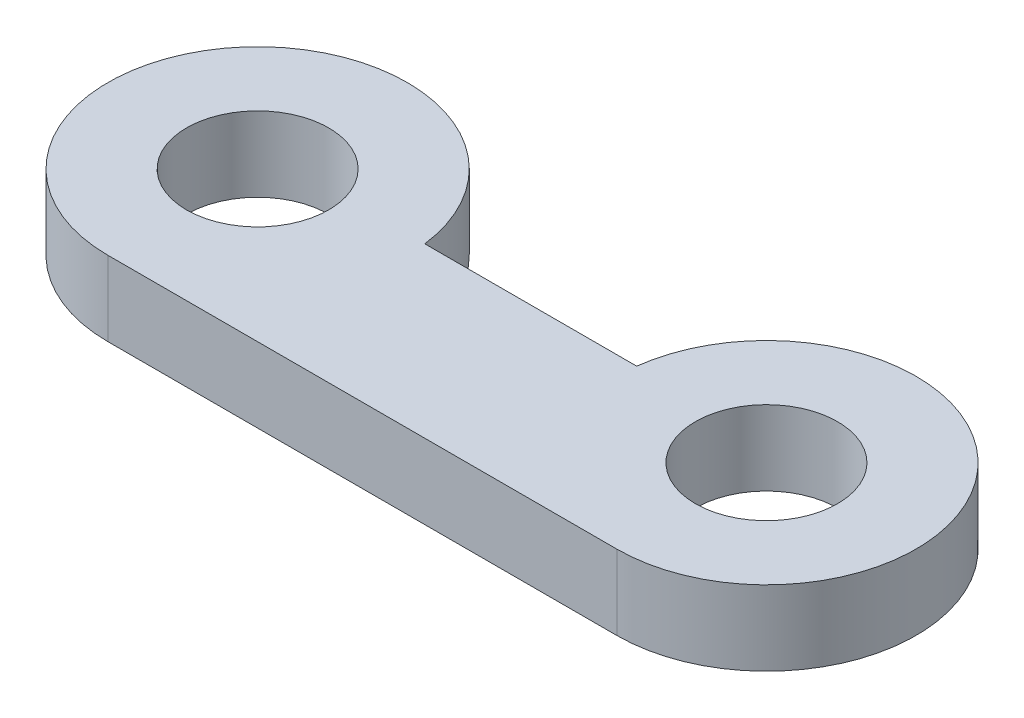
from build123d import *

# Parameters (mm, degrees)
SKETCH1_R           = 4
SKETCH1_R_2         = 1.9
BOSS_EXTRUDE1_DEPTH = 2


with BuildPart() as part:
    # Sketch1 → Boss-Extrude1 (new body)
    # profile 1 of 4: a face of its own
    with BuildSketch(Plane(origin=(0, 0, 0), x_dir=(1, 0, 0), z_dir=(0, 1, 0))):
        with Locations((-6.8, 4)):
            Circle(SKETCH1_R)
        with Locations(Location((-6.8, 4, 0), (0, 0, 270))):
            Circle(SKETCH1_R_2, mode=Mode.SUBTRACT)
    # profile 2 of 4: a face of its own
    with BuildSketch(Plane(origin=(0, 0, 0), x_dir=(1, 0, 0), z_dir=(0, 1, 0))):
        with BuildLine():
            Line((-6.8, 0), (0, 0))
            Line((0, 0), (0, 4.5))
            Line((0, 4.5), (-2.831373033, 4.5))
            ThreePointArc((-2.831373033, 4.5), (-2.807850963, 4.25049165), (-2.8, 4))
            ThreePointArc((-2.8, 4), (-3.971572875, 1.171572875), (-6.8, 0))
        make_face()
    # profile 3 of 4: a face of its own
    with BuildSketch(Plane(origin=(0, 0, 0), x_dir=(1, 0, 0), z_dir=(0, 1, 0))):
        with BuildLine():
            Line((0, 4.5), (0, 0))
            Line((0, 0), (6.8, 0))
            ThreePointArc((6.8, 0), (3.8, 1.354248689), (2.831373033, 4.5))
            Line((2.831373033, 4.5), (0, 4.5))
        make_face()
    # profile 4 of 4: a face of its own
    with BuildSketch(Plane(origin=(0, 0, 0), x_dir=(1, 0, 0), z_dir=(0, 1, 0))):
        with Locations((6.8, 4)):
            Circle(SKETCH1_R)
        with Locations(Location((6.8, 4, 0), (0, 0, 270))):
            Circle(SKETCH1_R_2, mode=Mode.SUBTRACT)
    extrude(amount=BOSS_EXTRUDE1_DEPTH)


solid = part.part
